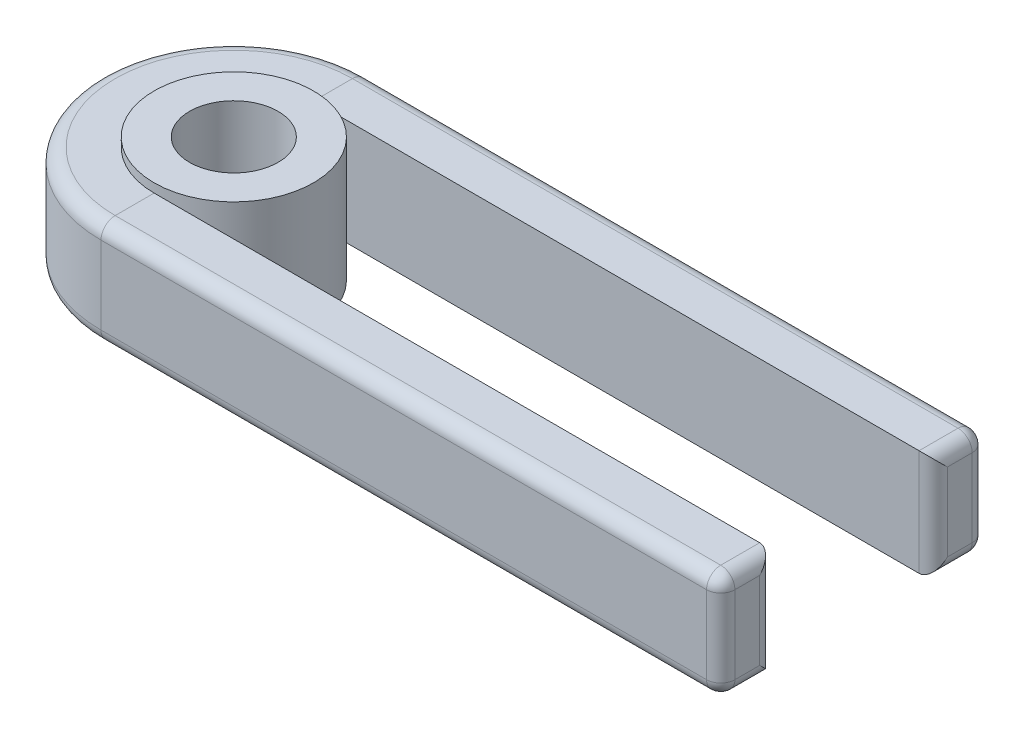
from build123d import *

# Parameters (mm, degrees)
SKETCH1_R           = 4.5
BOSS_EXTRUDE1_DEPTH = 7
SKETCH2_R           = 2.5
CUT_EXTRUDE1_DEPTH  = 10.460443964
SKETCH4_W           = 3
SKETCH4_H           = 6
FILLET1_R           = 0.8


with BuildPart() as part:
    # Sketch1 → Boss-Extrude1 (new body)
    with BuildSketch(Plane(origin=(0, 0, 0), x_dir=(1, 0, 0), z_dir=(0, 1, 0))):
        with Locations(Location((0, 0, 0), (0, 0, 90))):
            Circle(SKETCH1_R)
    extrude(amount=BOSS_EXTRUDE1_DEPTH)

    # Sketch2 → Cut-Extrude1 (cut, through all)
    with BuildSketch(Plane(origin=(0, 7, 0), x_dir=(1, 0, 0), z_dir=(0, 1, 0))):
        with Locations(Location((0, 0, 0), (0, 0, 270))):
            Circle(SKETCH2_R)
    extrude(amount=-CUT_EXTRUDE1_DEPTH, mode=Mode.SUBTRACT)

    # Sweep1: sweep along a path in Sketch3
    with BuildLine(Plane(origin=(0, 3.5, 0), x_dir=(1, 0, 0), z_dir=(0, 1, 0))) as sweep1_path:
        Line((35, 6), (0, 6))
        ThreePointArc((0, 6), (-6, 0), (0, -6))
        Line((0, -6), (35, -6))
    # Sketch4 → Sweep1 (sweep)
    with BuildSketch(Plane(origin=(35, 0, 0), x_dir=(0, 0, -1), z_dir=(1, 0, 0))):
        with Locations((6, 3.5)):
            Rectangle(SKETCH4_W, SKETCH4_H)
    sweep(path=sweep1_path.line)

    # Fillet1
    fillet1_edges = [part.edges().sort_by_distance(p)[0] for p in [
        (35, 3.5, -7.5),
        (35, 6.5, -6),
        (35, 3.5, -4.5),
        (35, 0.5, -6),
        (35, 3.5, 4.5),
        (17.5, 0.5, 7.5),
        (35, 0.5, 6),
        (17.5, 6.5, 7.5),
        (35, 3.5, 7.5),
        (35, 6.5, 6),
        (-7.5, 0.5, 0),
        (-7.5, 6.5, 0),
        (17.5, 0.5, -7.5),
        (17.5, 6.5, -7.5),
    ]]
    fillet(fillet1_edges, radius=FILLET1_R)


solid = part.part
